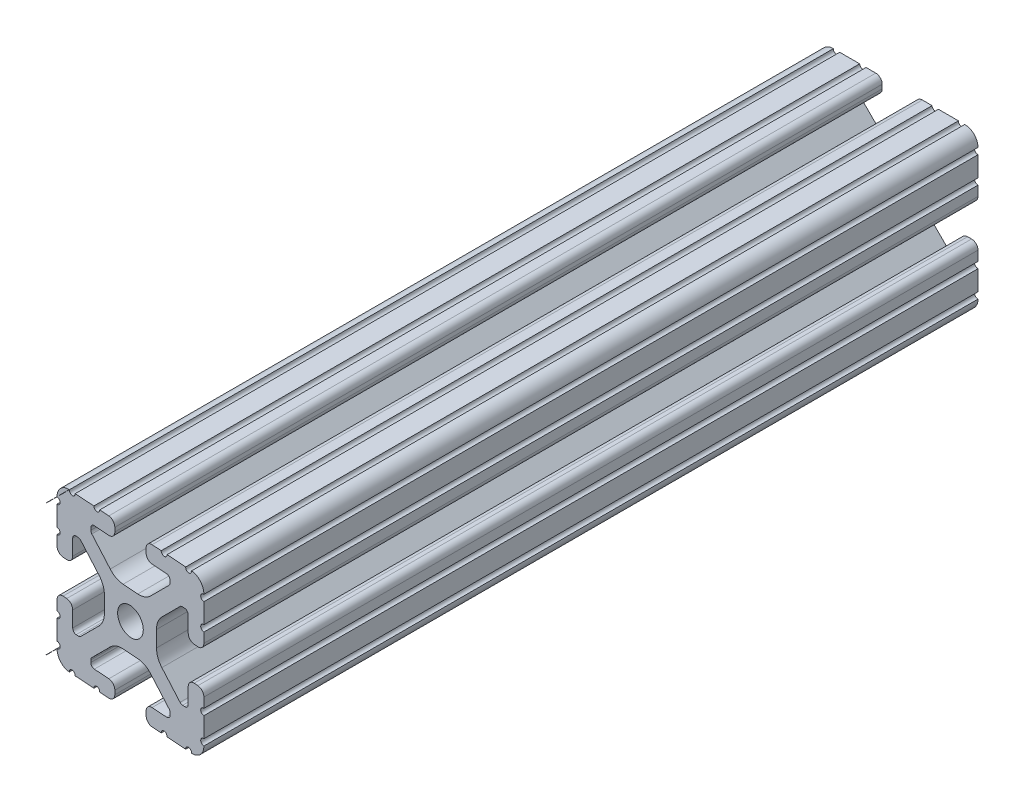
from build123d import *

# Parameters (mm, degrees)
SKETCH1_R          = 3.3274
EXTRUDE1_DEPTH     = 186.817
CUT_EXTRUDE1_DEPTH = 192.611893489


with BuildPart() as part:
    # Sketch1 → Extrude1 (new body)
    with BuildSketch(Plane.XY):
        with BuildLine():
            Line((-10.022898969, 12.91475973), (-5.252158105, 8.144007132))
            ThreePointArc((-5.252158105, 8.144007132), (-3.715177372, 7.117027388), (-1.902183975, 6.7564))
            Line((-1.902183975, 6.7564), (1.902183975, 6.7564))
            ThreePointArc((1.902183975, 6.7564), (3.715177372, 7.117027388), (5.252158105, 8.144007132))
            Line((5.252158105, 8.144007132), (10.022898969, 12.91475973))
            ThreePointArc((10.022898969, 12.91475973), (10.218362387, 13.207291992), (10.287, 13.552357131))
            Line((10.287, 13.552357131), (10.287, 14.0843))
            ThreePointArc((10.287, 14.0843), (10.022898185, 14.721898185), (9.3853, 14.986))
            Line((9.3853, 14.986), (5.617617549, 14.986))
            ThreePointArc((5.617617549, 14.986), (4.519044045, 15.441044045), (4.064, 16.539617549))
            Line((4.064, 16.539617549), (4.064, 17.496382451))
            ThreePointArc((4.064, 17.496382451), (4.519044045, 18.594955955), (5.617617549, 19.05))
            Line((5.617617549, 19.05), (7.974178704, 19.05))
            ThreePointArc((7.974178704, 19.05), (8.736178704, 18.288), (9.498178704, 19.05))
            Line((9.498178704, 19.05), (14.327719207, 19.05))
            ThreePointArc((14.327719207, 19.05), (15.087603123, 18.231251131), (15.847487039, 19.05))
            ThreePointArc((15.847487039, 19.05), (18.120176289, 18.120192083), (19.05, 15.847509295))
            ThreePointArc((19.05, 15.847509295), (18.231250992, 15.08762539), (19.05, 14.327741484))
            Line((19.05, 14.327741484), (19.05, 9.496091471))
            ThreePointArc((19.05, 9.496091471), (18.231250992, 8.736207565), (19.05, 7.97632366))
            Line((19.05, 7.97632366), (19.05, 5.617617549))
            ThreePointArc((19.05, 5.617617549), (18.594955955, 4.519044045), (17.496382451, 4.064))
            Line((17.496382451, 4.064), (16.539617549, 4.064))
            ThreePointArc((16.539617549, 4.064), (15.441044045, 4.519044045), (14.986, 5.617617549))
            Line((14.986, 5.617617549), (14.986, 9.385342516))
            ThreePointArc((14.986, 9.385342516), (14.721898185, 10.022940701), (14.0843, 10.287042516))
            Line((14.0843, 10.287042516), (13.516042086, 10.287042516))
            ThreePointArc((13.516042086, 10.287042516), (13.170975923, 10.218404478), (12.878443117, 10.022939917))
            Line((12.878443117, 10.022939917), (8.14758008, 5.292065243))
            ThreePointArc((8.14758008, 5.292065243), (7.117955879, 3.751120653), (6.7564, 1.933453584))
            Line((6.7564, 1.933453584), (6.7564, -1.933453584))
            ThreePointArc((6.7564, -1.933453584), (7.117955879, -3.751120653), (8.14758008, -5.292065243))
            Line((8.14758008, -5.292065243), (12.878443117, -10.022939917))
            ThreePointArc((12.878443117, -10.022939917), (13.170975923, -10.218404478), (13.516042086, -10.287042516))
            Line((13.516042086, -10.287042516), (14.0843, -10.287042516))
            ThreePointArc((14.0843, -10.287042516), (14.721898185, -10.022940701), (14.986, -9.385342516))
            Line((14.986, -9.385342516), (14.986, -5.617617549))
            ThreePointArc((14.986, -5.617617549), (15.441044045, -4.519044045), (16.539617549, -4.064))
            Line((16.539617549, -4.064), (17.496382451, -4.064))
            ThreePointArc((17.496382451, -4.064), (18.594955955, -4.519044045), (19.05, -5.617617549))
            Line((19.05, -5.617617549), (19.05, -7.976318491))
            ThreePointArc((19.05, -7.976318491), (18.231250992, -8.736202396), (19.05, -9.496086302))
            Line((19.05, -9.496086302), (19.05, -14.32774291))
            ThreePointArc((19.05, -14.32774291), (18.231250992, -15.087626816), (19.05, -15.847510721))
            ThreePointArc((19.05, -15.847510721), (18.120175716, -18.120192644), (15.847486868, -19.05))
            ThreePointArc((15.847486868, -19.05), (15.087602952, -18.231251131), (14.327719036, -19.05))
            Line((14.327719036, -19.05), (9.496062448, -19.05))
            ThreePointArc((9.496062448, -19.05), (8.736178532, -18.231251131), (7.976294616, -19.05))
            Line((7.976294616, -19.05), (5.617617549, -19.05))
            ThreePointArc((5.617617549, -19.05), (4.519044045, -18.594955955), (4.064, -17.496382451))
            Line((4.064, -17.496382451), (4.064, -16.539617549))
            ThreePointArc((4.064, -16.539617549), (4.519044045, -15.441044045), (5.617617549, -14.986))
            Line((5.617617549, -14.986), (9.3853, -14.986))
            ThreePointArc((9.3853, -14.986), (10.022898185, -14.721898185), (10.287, -14.0843))
            Line((10.287, -14.0843), (10.287, -13.552357131))
            ThreePointArc((10.287, -13.552357131), (10.218362387, -13.207291992), (10.022898969, -12.91475973))
            Line((10.022898969, -12.91475973), (5.252158105, -8.144007132))
            ThreePointArc((5.252158105, -8.144007132), (3.715177372, -7.117027388), (1.902183975, -6.7564))
            Line((1.902183975, -6.7564), (-1.902183975, -6.7564))
            ThreePointArc((-1.902183975, -6.7564), (-3.715177372, -7.117027388), (-5.252158105, -8.144007132))
            Line((-5.252158105, -8.144007132), (-10.022898969, -12.91475973))
            ThreePointArc((-10.022898969, -12.91475973), (-10.218362387, -13.207291992), (-10.287, -13.552357131))
            Line((-10.287, -13.552357131), (-10.287, -14.0843))
            ThreePointArc((-10.287, -14.0843), (-10.022898185, -14.721898185), (-9.3853, -14.986))
            Line((-9.3853, -14.986), (-5.617617549, -14.986))
            ThreePointArc((-5.617617549, -14.986), (-4.519044045, -15.441044045), (-4.064, -16.539617549))
            Line((-4.064, -16.539617549), (-4.064, -17.496382451))
            ThreePointArc((-4.064, -17.496382451), (-4.519044045, -18.594955955), (-5.617617549, -19.05))
            Line((-5.617617549, -19.05), (-7.976294616, -19.05))
            ThreePointArc((-7.976294616, -19.05), (-8.736178532, -18.231251131), (-9.496062448, -19.05))
            Line((-9.496062448, -19.05), (-14.327719036, -19.05))
            ThreePointArc((-14.327719036, -19.05), (-15.087602952, -18.231251131), (-15.847486868, -19.05))
            ThreePointArc((-15.847486868, -19.05), (-18.120175716, -18.120192644), (-19.05, -15.847510721))
            ThreePointArc((-19.05, -15.847510721), (-18.231250992, -15.087626816), (-19.05, -14.32774291))
            Line((-19.05, -14.32774291), (-19.05, -9.496086302))
            ThreePointArc((-19.05, -9.496086302), (-18.231250992, -8.736202396), (-19.05, -7.976318491))
            Line((-19.05, -7.976318491), (-19.05, -5.617617549))
            ThreePointArc((-19.05, -5.617617549), (-18.594955955, -4.519044045), (-17.496382451, -4.064))
            Line((-17.496382451, -4.064), (-16.539617549, -4.064))
            ThreePointArc((-16.539617549, -4.064), (-15.441044045, -4.519044045), (-14.986, -5.617617549))
            Line((-14.986, -5.617617549), (-14.986, -9.385342516))
            ThreePointArc((-14.986, -9.385342516), (-14.721898185, -10.022940701), (-14.0843, -10.287042516))
            Line((-14.0843, -10.287042516), (-13.516042086, -10.287042516))
            ThreePointArc((-13.516042086, -10.287042516), (-13.170975923, -10.218404478), (-12.878443117, -10.022939917))
            Line((-12.878443117, -10.022939917), (-8.14758008, -5.292065243))
            ThreePointArc((-8.14758008, -5.292065243), (-7.117955879, -3.751120653), (-6.7564, -1.933453584))
            Line((-6.7564, -1.933453584), (-6.7564, 1.933453584))
            ThreePointArc((-6.7564, 1.933453584), (-7.117955879, 3.751120653), (-8.14758008, 5.292065243))
            Line((-8.14758008, 5.292065243), (-12.878443117, 10.022939917))
            ThreePointArc((-12.878443117, 10.022939917), (-13.170975923, 10.218404478), (-13.516042086, 10.287042516))
            Line((-13.516042086, 10.287042516), (-14.0843, 10.287042516))
            ThreePointArc((-14.0843, 10.287042516), (-14.721898185, 10.022940701), (-14.986, 9.385342516))
            Line((-14.986, 9.385342516), (-14.986, 5.617617549))
            ThreePointArc((-14.986, 5.617617549), (-15.441044045, 4.519044045), (-16.539617549, 4.064))
            Line((-16.539617549, 4.064), (-17.496382451, 4.064))
            ThreePointArc((-17.496382451, 4.064), (-18.594955955, 4.519044045), (-19.05, 5.617617549))
            Line((-19.05, 5.617617549), (-19.05, 7.97632366))
            ThreePointArc((-19.05, 7.97632366), (-18.231250992, 8.736207565), (-19.05, 9.496091471))
            Line((-19.05, 9.496091471), (-19.05, 14.327741484))
            ThreePointArc((-19.05, 14.327741484), (-18.231250992, 15.08762539), (-19.05, 15.847509295))
            ThreePointArc((-19.05, 15.847509295), (-18.120176289, 18.120192083), (-15.847487039, 19.05))
            ThreePointArc((-15.847487039, 19.05), (-15.087603123, 18.231251131), (-14.327719207, 19.05))
            Line((-14.327719207, 19.05), (-9.498178704, 19.05))
            ThreePointArc((-9.498178704, 19.05), (-8.736178704, 18.288), (-7.974178704, 19.05))
            Line((-7.974178704, 19.05), (-5.617617549, 19.05))
            ThreePointArc((-5.617617549, 19.05), (-4.519044045, 18.594955955), (-4.064, 17.496382451))
            Line((-4.064, 17.496382451), (-4.064, 16.539617549))
            ThreePointArc((-4.064, 16.539617549), (-4.519044045, 15.441044045), (-5.617617549, 14.986))
            Line((-5.617617549, 14.986), (-9.3853, 14.986))
            ThreePointArc((-9.3853, 14.986), (-10.022898185, 14.721898185), (-10.287, 14.0843))
            Line((-10.287, 14.0843), (-10.287, 13.552357131))
            ThreePointArc((-10.287, 13.552357131), (-10.218362387, 13.207291992), (-10.022898969, 12.91475973))
        make_face()
        Circle(SKETCH1_R, mode=Mode.SUBTRACT)
    extrude(amount=-EXTRUDE1_DEPTH)

    # Sketch2 → Cut-Extrude1 (cut, through all)
    with BuildSketch(Plane(origin=(0, 19.05, 0), x_dir=(1, 0, 0), z_dir=(0, 1, 0))):
        Polygon((19.05, 0), (-19.05, 2.664211535), (-19.05, 0), align=None)
    extrude(amount=-CUT_EXTRUDE1_DEPTH, mode=Mode.SUBTRACT)


solid = part.part
